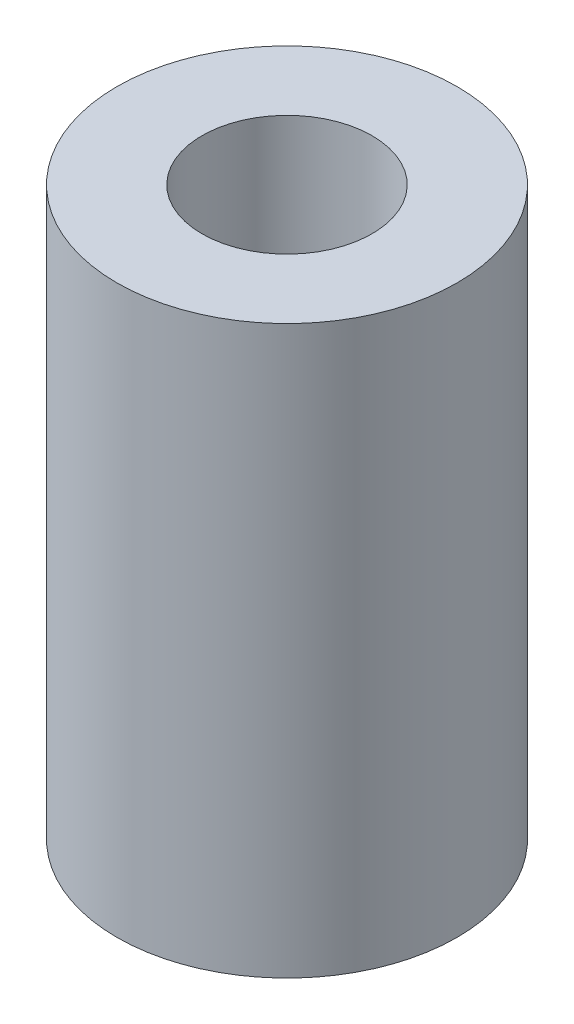
from build123d import *

# Parameters (mm, degrees)
SKETCH1_R           = 6
BOSS_EXTRUDE3_DEPTH = 20
SKETCH5_R           = 3
CUT_EXTRUDE2_DEPTH  = 9
SKETCH6_R           = 1
CUT_EXTRUDE3_DEPTH  = 9


with BuildPart() as part:
    # Sketch1 → Boss-Extrude3 (new body)
    with BuildSketch(Plane(origin=(0, 0, 0), x_dir=(1, 0, 0), z_dir=(0, 1, 0))):
        with Locations(Location((0, 0, 0), (0, 0, 270))):
            Circle(SKETCH1_R)
    extrude(amount=BOSS_EXTRUDE3_DEPTH)

    # Sketch5 → Cut-Extrude2 (cut)
    with BuildSketch(Plane(origin=(0, 20, 0), x_dir=(1, 0, 0), z_dir=(0, 1, 0))):
        with Locations(Location((0, 0, 0), (0, 0, 270))):
            Circle(SKETCH5_R)
    extrude(amount=-CUT_EXTRUDE2_DEPTH, mode=Mode.SUBTRACT)

    # Sketch6 → Cut-Extrude3 (cut)
    with BuildSketch(Plane.XZ):
        with Locations(Location((0, 0, 0), (0, 0, 270))):
            Circle(SKETCH6_R)
    extrude(amount=-CUT_EXTRUDE3_DEPTH, mode=Mode.SUBTRACT)


solid = part.part
